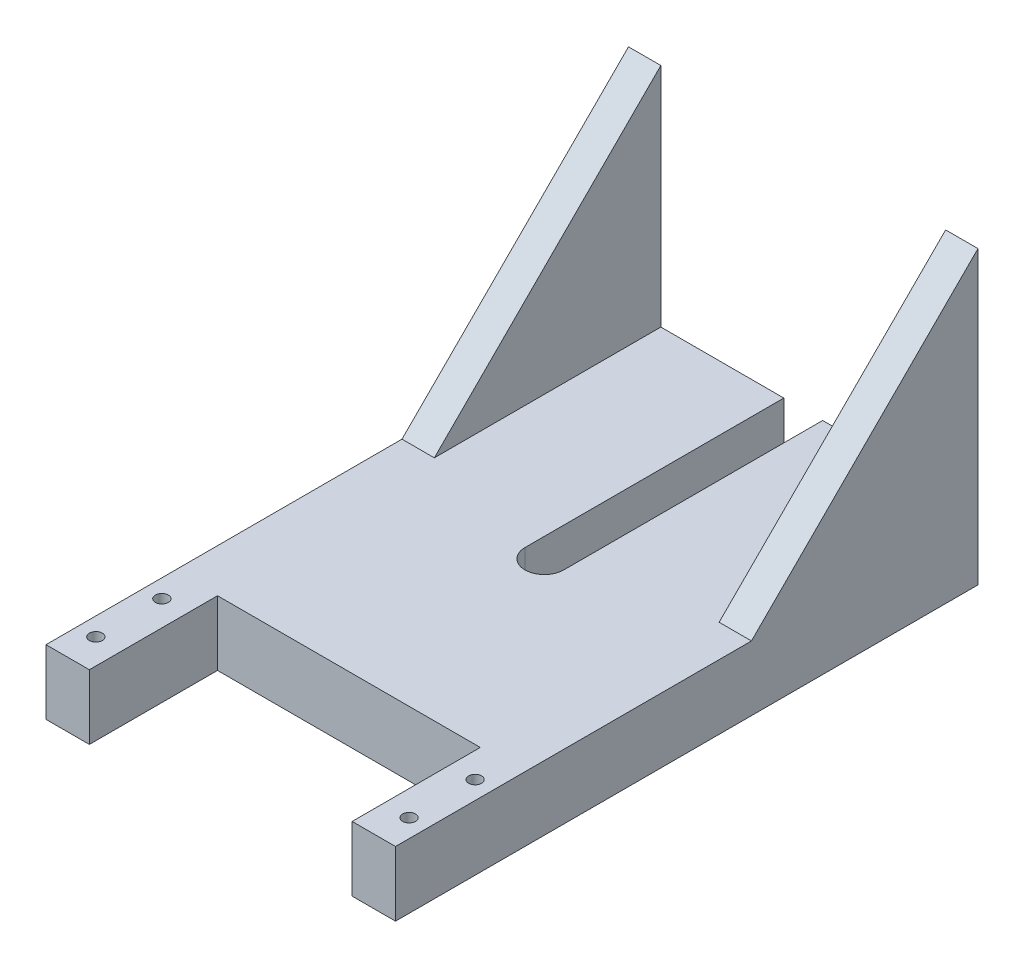
from build123d import *

# Parameters (mm, degrees)
SKETCH1_W           = 54
SKETCH1_H           = 10
BOSS_EXTRUDE1_DEPTH = 90
SKETCH2_W           = 40.6
SKETCH2_H           = 19.8
CUT_EXTRUDE1_DEPTH  = 99.192875432
CUT_EXTRUDE2_DEPTH  = 99.192875432
BOSS_EXTRUDE4_DEPTH = 5
BOSS_EXTRUDE5_DEPTH = 5
SKETCH9_R           = 1
CUT_EXTRUDE3_DEPTH  = 108.549248187


with BuildPart() as part:
    # Sketch1 → Boss-Extrude1 (new body)
    with BuildSketch(Plane.XY):
        with Locations((10.971578656, 527.175634265)):
            Rectangle(SKETCH1_W, SKETCH1_H)
    extrude(amount=BOSS_EXTRUDE1_DEPTH)

    # Sketch2 → Cut-Extrude1 (cut, through all)
    with BuildSketch(Plane.XZ.offset(-522.175634265)):
        with Locations((10.971578656, 80.1)):
            Rectangle(SKETCH2_W, SKETCH2_H)
    extrude(amount=-CUT_EXTRUDE1_DEPTH, mode=Mode.SUBTRACT)

    # Sketch4 → Cut-Extrude2 (cut, through all)
    with BuildSketch(Plane(origin=(0, 532.175634265, 0), x_dir=(1, 0, 0), z_dir=(0, 1, 0))):
        with BuildLine():
            Line((7.971578656, -40), (7.971578656, 0))
            ThreePointArc((7.971578656, 0), (10.971578656, 3), (13.971578656, 0))
            Line((13.971578656, 0), (13.971578656, -40))
            ThreePointArc((13.971578656, -40), (10.971578656, -43), (7.971578656, -40))
        make_face()
    extrude(amount=-CUT_EXTRUDE2_DEPTH, mode=Mode.SUBTRACT)

    # Sketch7 → Boss-Extrude4 (add)
    with BuildSketch(Plane.ZY.offset(16.028421344)):
        Polygon((35, 532.175634265), (0, 567.175634265), (0, 532.175634265), align=None)
    extrude(amount=-BOSS_EXTRUDE4_DEPTH)

    # Sketch8 → Boss-Extrude5 (add)
    with BuildSketch(Plane(origin=(37.971578656, 0, 0), x_dir=(0, 0, -1), z_dir=(1, 0, 0))):
        Polygon((-35, 532.175634265), (0, 567.175634265), (0, 532.175634265), align=None)
    extrude(amount=-BOSS_EXTRUDE5_DEPTH)

    # Sketch9 → Cut-Extrude3 (cut, through all)
    with BuildSketch(Plane.XZ.offset(-522.175634265)):
        with Locations(Location((-13.228421344, 85.1, 0), (0, 0, 270))):
            Circle(SKETCH9_R)
        with Locations(Location((-13.228421344, 74.9, 0), (0, 0, 270))):
            Circle(SKETCH9_R)
        with Locations(Location((35.171578656, 74.9, 0), (0, 0, 270))):
            Circle(SKETCH9_R)
        with Locations(Location((35.171578656, 85.1, 0), (0, 0, 270))):
            Circle(SKETCH9_R)
    extrude(amount=-CUT_EXTRUDE3_DEPTH, mode=Mode.SUBTRACT)


solid = part.part
